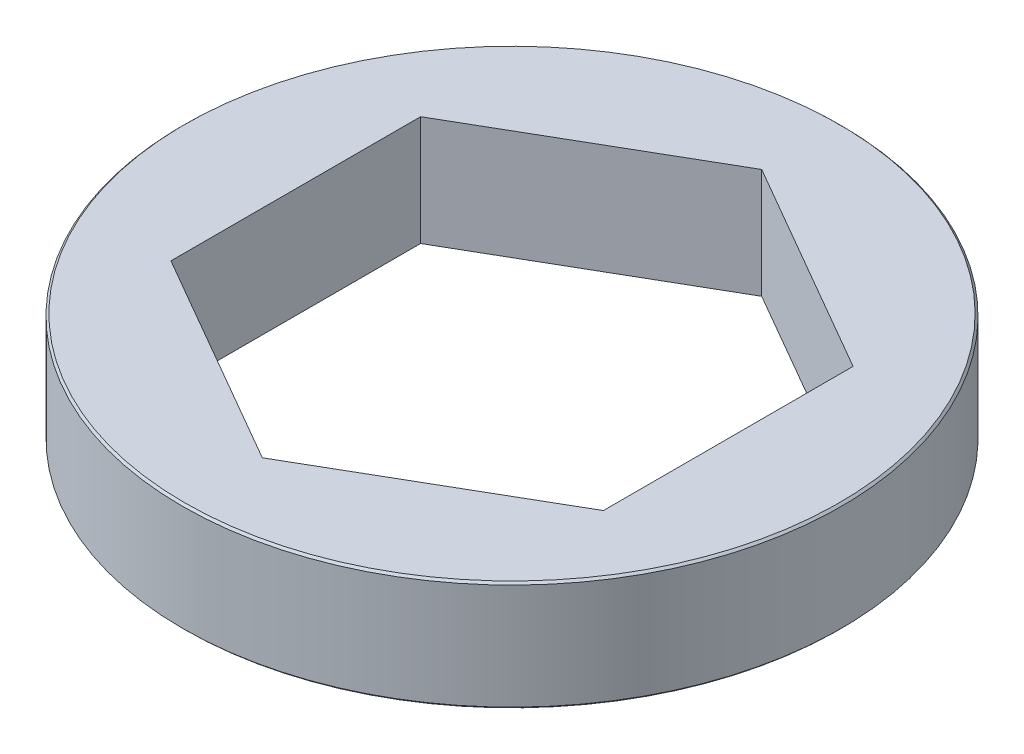
from build123d import *

# Parameters (mm, degrees)
SKETCH1_R           = 9.525
BOSS_EXTRUDE1_DEPTH = 3.175
CHAMFER1_SIZE       = 0.06
CHAMFER2_SIZE       = 0.06


with BuildPart() as part:
    # Sketch1 → Boss-Extrude1 (new body)
    with BuildSketch(Plane(origin=(0, 0, 0), x_dir=(1, 0, 0), z_dir=(0, 1, 0))):
        with Locations(Location((0, 0, 0), (0, 0, 270))):
            Circle(SKETCH1_R)
        Polygon((0, 7.216878365), (-6.25, 3.608439182), (-6.25, -3.608439182), (0, -7.216878365), (6.25, -3.608439182), (6.25, 3.608439182), align=None, mode=Mode.SUBTRACT)
    extrude(amount=BOSS_EXTRUDE1_DEPTH)

    # Chamfer1
    chamfer1_edges = [part.edges().sort_by_distance(p)[0] for p in [
        (0, 0, -9.525),
    ]]
    chamfer(chamfer1_edges, length=CHAMFER1_SIZE)

    # Chamfer2
    chamfer2_edges = [part.edges().sort_by_distance(p)[0] for p in [
        (0, 3.175, -9.525),
    ]]
    chamfer(chamfer2_edges, length=CHAMFER2_SIZE)


solid = part.part
